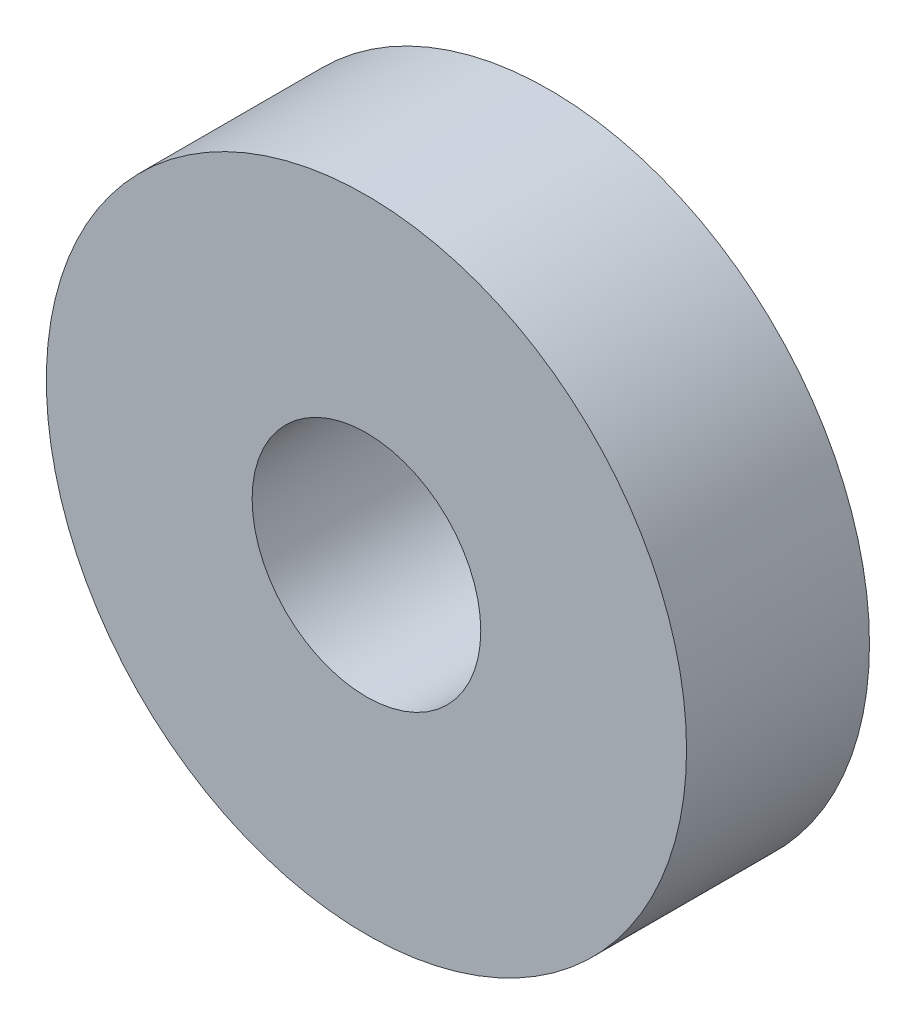
from build123d import *

# Parameters (mm, degrees)
SKETCH_1_R          = 7
EXTRUDE_1_DEPTH     = 4
SKETCH_2_R          = 2.5
CUT_EXTRUDE_1_DEPTH = 4


with BuildPart() as part:
    # 草圖1 → 填料-伸長1 (new body)
    with BuildSketch(Plane.XY):
        Circle(SKETCH_1_R)
    extrude(amount=EXTRUDE_1_DEPTH)

    # 草圖2 → 除料-伸長1 (cut)
    with BuildSketch(Plane.XY.offset(4)):
        Circle(SKETCH_2_R)
    extrude(amount=-CUT_EXTRUDE_1_DEPTH, mode=Mode.SUBTRACT)


solid = part.part
